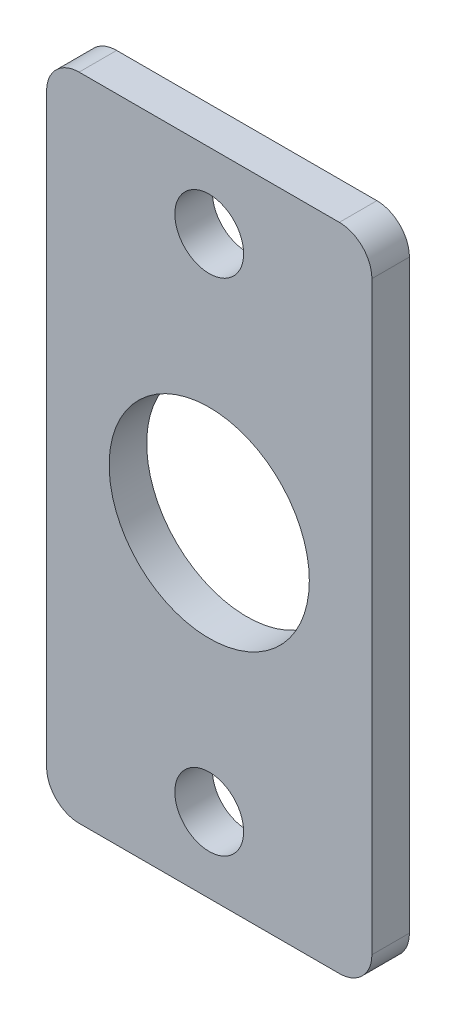
from build123d import *

# Parameters (mm, degrees)
SKETCH_2_W           = 26
SKETCH_2_H           = 52
EXTRUDE_1_DEPTH      = 3
SKETCH_4_R           = 8
CUT_EXTRUDE_2_DEPTH  = 30.223278392
FILLET_1_R           = 2.6
SKETCH_3_R           = 2.75
CUT_EXTRUDE_16_DEPTH = 30.223278392


with BuildPart() as part:
    # 草图2 → 凸台-拉伸1 (new body)
    with BuildSketch(Plane.XY):
        Rectangle(SKETCH_2_W, SKETCH_2_H)
    extrude(amount=EXTRUDE_1_DEPTH)

    # 草图4 → 切除-拉伸2 (cut, through all)
    with BuildSketch(Plane.XY.offset(3)):
        Circle(SKETCH_4_R)
    extrude(amount=-CUT_EXTRUDE_2_DEPTH, mode=Mode.SUBTRACT)

    # 圆角1
    fillet_1_edges = [part.edges().sort_by_distance(p)[0] for p in [
        (-13, -26, 1.5),
        (-13, 26, 1.5),
        (13, 26, 1.5),
        (13, -26, 1.5),
    ]]
    fillet(fillet_1_edges, radius=FILLET_1_R)

    # 草图3 → 16 (cut, through all)
    with BuildSketch(Plane.XY.offset(3)):
        with Locations((0, 20)):
            Circle(SKETCH_3_R)
        with Locations(Location((0, -20, 0), (0, 0, 180))):
            Circle(SKETCH_3_R)
    extrude(amount=-CUT_EXTRUDE_16_DEPTH, mode=Mode.SUBTRACT)


solid = part.part
